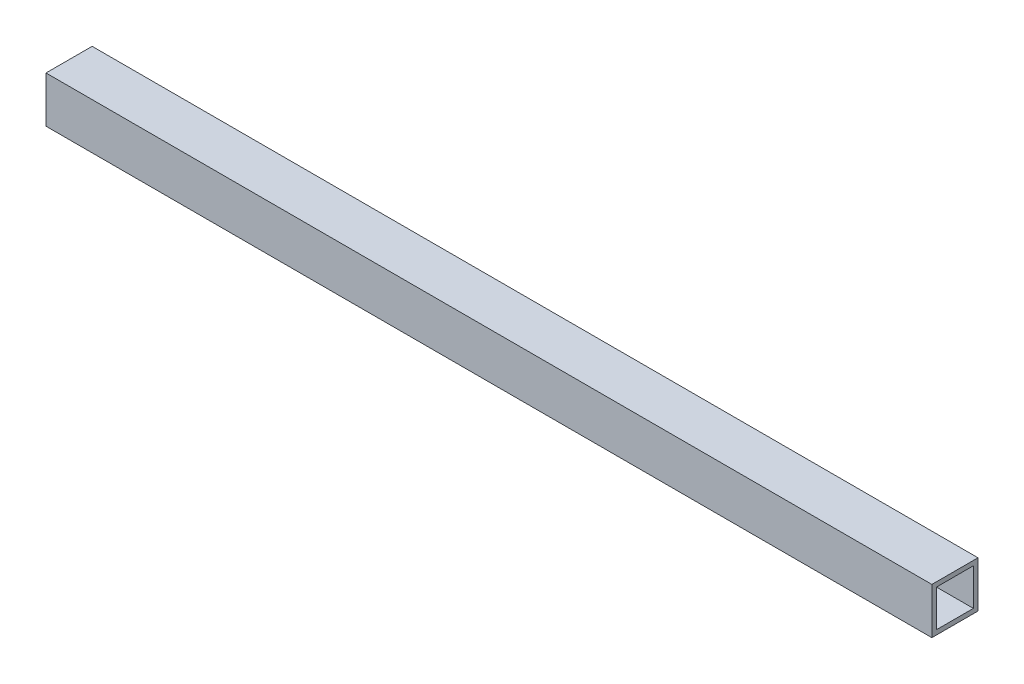
from build123d import *

# Parameters (mm, degrees)
SKETCH1_W           = 31.75
SKETCH1_H           = 31.75
SKETCH1_W_2         = 25.4
SKETCH1_H_2         = 25.4
BOSS_EXTRUDE1_DEPTH = 609.6


with BuildPart() as part:
    # Sketch1 → Boss-Extrude1 (new body)
    with BuildSketch(Plane(origin=(0, 0, 0), x_dir=(0, 0, -1), z_dir=(1, 0, 0))):
        with Locations((15.875, 15.875)):
            Rectangle(SKETCH1_W, SKETCH1_H)
        with Locations((15.875, 15.875)):
            Rectangle(SKETCH1_W_2, SKETCH1_H_2, mode=Mode.SUBTRACT)
    extrude(amount=BOSS_EXTRUDE1_DEPTH)


solid = part.part
